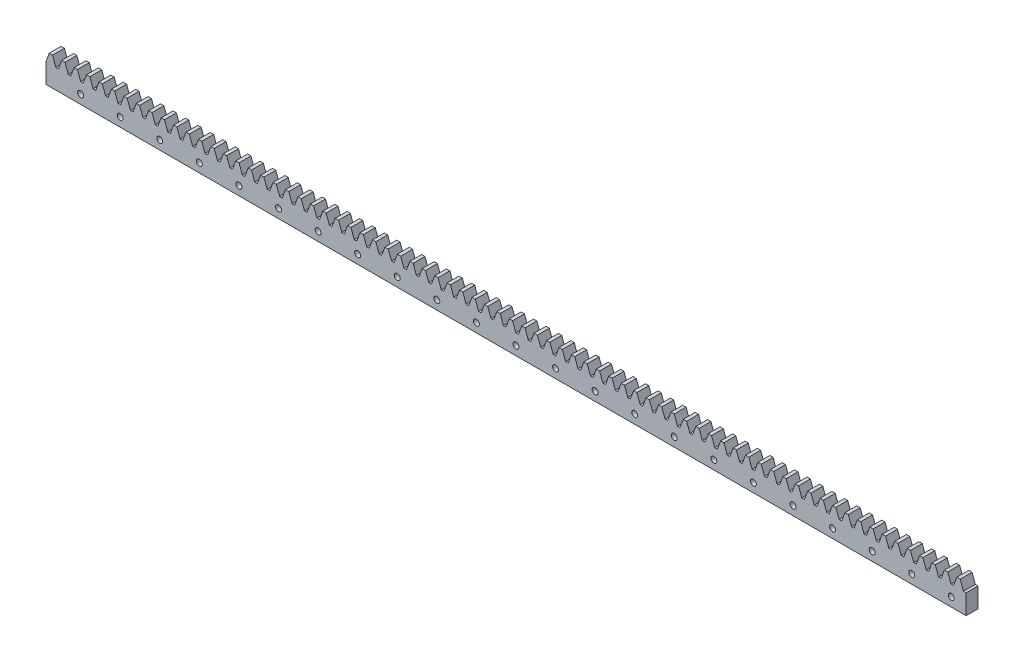
from build123d import *

# Parameters (mm, degrees)
SKETCH_1_W             = 465
SKETCH_1_H             = 10
EXTRUDE_1_DEPTH        = 6
EXTRUDE_2_DEPTH        = 6
PATTERN_LINEAR_1_COUNT = 74
PATTERN_LINEAR_1_PITCH = 6.283185307
SKETCH_3_R             = 1.5
CUT_EXTRUDE_1_DEPTH    = 10
PATTERN_LINEAR_2_COUNT = 24
PATTERN_LINEAR_2_PITCH = 20


with BuildPart() as part:
    # 草图1 → 拉伸1 (new body)
    with BuildSketch(Plane.XY):
        with Locations((232.5, -5)):
            Rectangle(SKETCH_1_W, SKETCH_1_H)
    extrude(amount=EXTRUDE_1_DEPTH)

    # 草图2 → 拉伸2 (add)
    with BuildSketch(Plane.XY.offset(6)):
        Polygon((0, 0), (1.637866054, 4.5), (3.323577771, 4.5), (4.961443825, 0), align=None)
    extrude_2 = extrude(amount=-EXTRUDE_2_DEPTH)

    # 阵列(线性)1: 拉伸2 ×74
    with Locations(*[(i * PATTERN_LINEAR_1_PITCH, 0, 0) for i in range(1, PATTERN_LINEAR_1_COUNT)]):
        add(extrude_2)

    # 草图3 → 切除-拉伸1 (cut)
    with BuildSketch(Plane.XY.offset(6)):
        with Locations((457.5, -5.5)):
            Circle(SKETCH_3_R)
    cut_extrude_1 = extrude(amount=-CUT_EXTRUDE_1_DEPTH, mode=Mode.SUBTRACT)

    # 阵列(线性)2: 切除-拉伸1 ×24
    with Locations(*[(-i * PATTERN_LINEAR_2_PITCH, 0, 0) for i in range(1, PATTERN_LINEAR_2_COUNT)]):
        add(cut_extrude_1, mode=Mode.SUBTRACT)


solid = part.part
